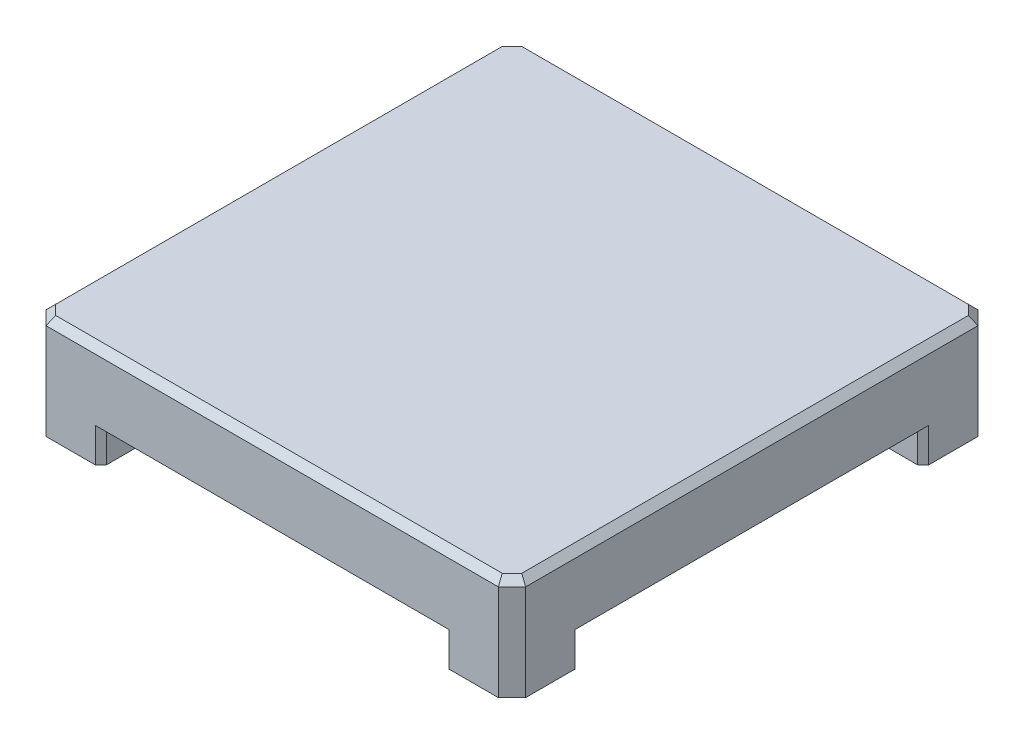
from build123d import *

# Parameters (mm, degrees)
SKETCH1_W           = 88.9
SKETCH1_H           = 88.9
BOSS_EXTRUDE1_DEPTH = 19.05
CUT_EXTRUDE1_DEPTH  = 6.35
LEGS_OUTER_SIZE     = 2.54
TOP_FACE_SIZE       = 1.27
LEGS_INNER_SIZE     = 1.016


with BuildPart() as part:
    # Sketch1 → Boss-Extrude1 (new body)
    with BuildSketch(Plane(origin=(0, 0, 0), x_dir=(1, 0, 0), z_dir=(0, 1, 0))):
        Rectangle(SKETCH1_W, SKETCH1_H)
    extrude(amount=BOSS_EXTRUDE1_DEPTH)

    # Sketch1<3> → Cut-Extrude1 (cut)
    with BuildSketch(Plane(origin=(0, 0, 0), x_dir=(1, 0, 0), z_dir=(0, 1, 0))):
        Polygon((-44.45, -31.75), (-31.75, -31.75), (-31.75, -44.45), (31.75, -44.45), (31.75, -31.75), (44.45, -31.75), (44.45, 31.75), (31.75, 31.75), (31.75, 44.45), (-31.75, 44.45), (-31.75, 31.75), (-44.45, 31.75), align=None)
    extrude(amount=CUT_EXTRUDE1_DEPTH, mode=Mode.SUBTRACT)

    # legs, outer
    legs_outer_edges = [part.edges().sort_by_distance(p)[0] for p in [
        (-44.45, 9.525, 44.45),
        (44.45, 9.525, 44.45),
        (44.45, 9.525, -44.45),
        (-44.45, 9.525, -44.45),
    ]]
    chamfer(legs_outer_edges, length=LEGS_OUTER_SIZE)

    # top face
    top_face_edges = [part.edges().sort_by_distance(p)[0] for p in [
        (0, 19.05, -44.45),
        (44.45, 19.05, 0),
        (-44.45, 19.05, 0),
        (0, 19.05, 44.45),
        (-43.18, 19.05, -43.18),
        (-43.18, 19.05, 43.18),
        (43.18, 19.05, 43.18),
        (43.18, 19.05, -43.18),
    ]]
    chamfer(top_face_edges, length=TOP_FACE_SIZE)

    # legs, inner
    legs_inner_edges = [part.edges().sort_by_distance(p)[0] for p in [
        (-44.45, 3.175, 31.75),
        (-44.45, 3.175, -31.75),
        (-31.75, 3.175, -31.75),
        (-31.75, 3.175, -44.45),
        (31.75, 3.175, -44.45),
        (31.75, 3.175, -31.75),
        (44.45, 3.175, -31.75),
        (44.45, 3.175, 31.75),
        (31.75, 3.175, 31.75),
        (31.75, 3.175, 44.45),
        (-31.75, 3.175, 44.45),
        (-31.75, 3.175, 31.75),
    ]]
    chamfer(legs_inner_edges, length=LEGS_INNER_SIZE)


solid = part.part
